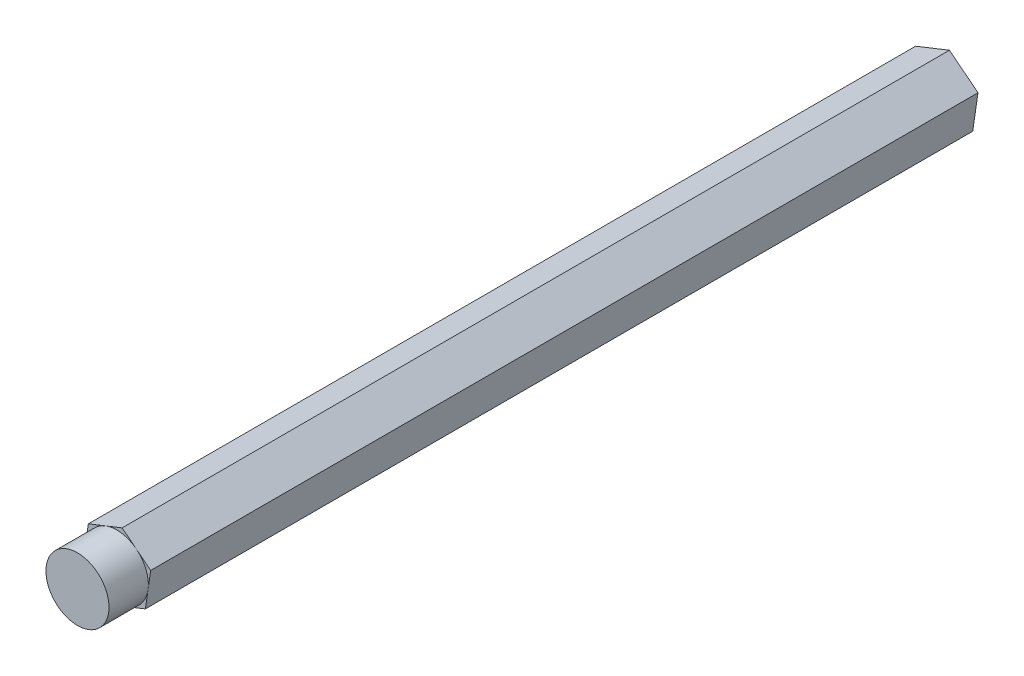
from build123d import *

# Parameters (mm, degrees)
BOSS_EXTRUDE1_DEPTH = 174.6377
SKETCH2_R           = 7.332348419
SKETCH2_R_2         = 6.35
CUT_EXTRUDE1_DEPTH  = 7.9375


with BuildPart() as part:
    # Sketch1 → Boss-Extrude1 (new body)
    with BuildSketch(Plane.XY):
        Polygon((1.064896502, 7.254607417), (-5.750226067, 4.549531131), (-6.815122568, -2.705076286), (-1.064896502, -7.254607417), (5.750226067, -4.549531131), (6.815122568, 2.705076286), align=None)
    extrude(amount=BOSS_EXTRUDE1_DEPTH)

    # Sketch2 → Cut-Extrude1 (cut)
    with BuildSketch(Plane.XY.offset(174.6377)):
        Circle(SKETCH2_R)
        Circle(SKETCH2_R_2, mode=Mode.SUBTRACT)
    extrude(amount=-CUT_EXTRUDE1_DEPTH, mode=Mode.SUBTRACT)


solid = part.part
